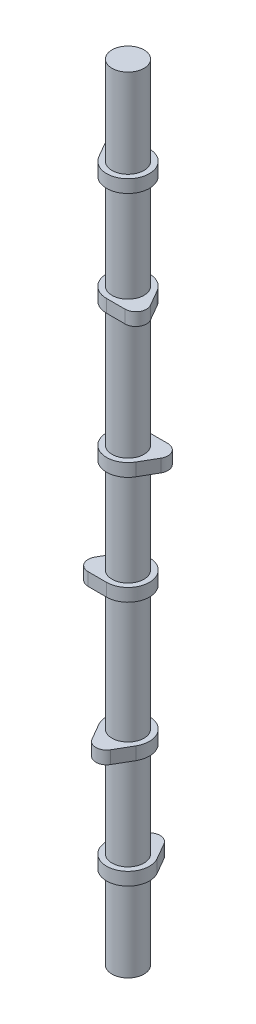
from build123d import *

# Parameters (mm, degrees)
BOSS_EXTRUDE1_DEPTH   = 7.62
LPATTERN4_COUNT       = 2
LPATTERN4_PITCH       = 64.25
BODY_MOVE_COPY6_ANGLE = 180
LPATTERN7_COUNT       = 3
LPATTERN7_PITCH       = 146.05
BODY_MOVE_COPY7_ANGLE = 120
BODY_MOVE_COPY8_ANGLE = 120
BOSS_EXTRUDE2_START   = -49.53
SKETCH2_R             = 9.5
BOSS_EXTRUDE2_DEPTH   = 466.09


with BuildPart() as part:
    # Sketch1 → Boss-Extrude1 (new body)
    with BuildSketch(Plane(origin=(0, 0, 0), x_dir=(1, 0, 0), z_dir=(0, 1, 0))):
        with BuildLine():
            Line((-5.499261314, 15.875), (-10.998522628, 6.35))
            ThreePointArc((-10.998522628, 6.35), (0, -12.7), (10.998522628, 6.35))
            Line((10.998522628, 6.35), (5.499261314, 15.875))
            ThreePointArc((5.499261314, 15.875), (0, 19.05), (-5.499261314, 15.875))
        make_face()
    extrude(amount=BOSS_EXTRUDE1_DEPTH)


with BuildPart() as lpattern4_1:
    # LPattern4: pattern copy
    add(part.part.moved(Location(Vector(0, 1, 0) * (1 * LPATTERN4_PITCH))))


with BuildPart() as lpattern4_1_1:
    # Body-Move/Copy6: moved
    add(lpattern4_1.part.rotate(Axis((0, 0, 0), (0, 1, 0)), BODY_MOVE_COPY6_ANGLE))


with BuildPart() as lpattern7_1:
    # LPattern7: pattern copy
    add(part.part.moved(Location(Vector(0, 1, 0) * (1 * LPATTERN7_PITCH))))


with BuildPart() as lpattern7_2:
    # LPattern7: pattern copy
    add(part.part.moved(Location(Vector(0, 1, 0) * (2 * LPATTERN7_PITCH))))


with BuildPart() as lpattern7_3:
    # LPattern7: pattern copy
    add(lpattern4_1_1.part.moved(Location(Vector(0, 1, 0) * (1 * LPATTERN7_PITCH))))


with BuildPart() as lpattern7_4:
    # LPattern7: pattern copy
    add(lpattern4_1_1.part.moved(Location(Vector(0, 1, 0) * (2 * LPATTERN7_PITCH))))


with BuildPart() as lpattern7_1_1:
    # Body-Move/Copy7: moved
    add(lpattern7_1.part.rotate(Axis((0, 0, 0), (0, 1, 0)), BODY_MOVE_COPY7_ANGLE))


with BuildPart() as lpattern7_3_1:
    # Body-Move/Copy7: moved
    add(lpattern7_3.part.rotate(Axis((0, 0, 0), (0, 1, 0)), BODY_MOVE_COPY7_ANGLE))


with BuildPart() as lpattern7_2_1:
    # Body-Move/Copy8: moved
    add(lpattern7_2.part.rotate(Axis((0, 0, 0), (0, -1, 0)), BODY_MOVE_COPY8_ANGLE))


with BuildPart() as lpattern7_4_1:
    # Body-Move/Copy8: moved
    add(lpattern7_4.part.rotate(Axis((0, 0, 0), (0, -1, 0)), BODY_MOVE_COPY8_ANGLE))


with BuildPart() as part_1:
    add(part.part)

    add(lpattern4_1_1.part)  # Boss-Extrude2 merges LPattern4_1

    add(lpattern7_1_1.part)  # Boss-Extrude2 merges LPattern7_1

    add(lpattern7_2_1.part)  # Boss-Extrude2 merges LPattern7_2

    add(lpattern7_3_1.part)  # Boss-Extrude2 merges LPattern7_3

    add(lpattern7_4_1.part)  # Boss-Extrude2 merges LPattern7_4
    # Sketch2 → Boss-Extrude2 (add)
    with BuildSketch(Plane(origin=(0, 0, 0), x_dir=(1, 0, 0), z_dir=(0, 1, 0)).offset(BOSS_EXTRUDE2_START)):
        Circle(SKETCH2_R)
    extrude(amount=BOSS_EXTRUDE2_DEPTH)


solid = part_1.part
